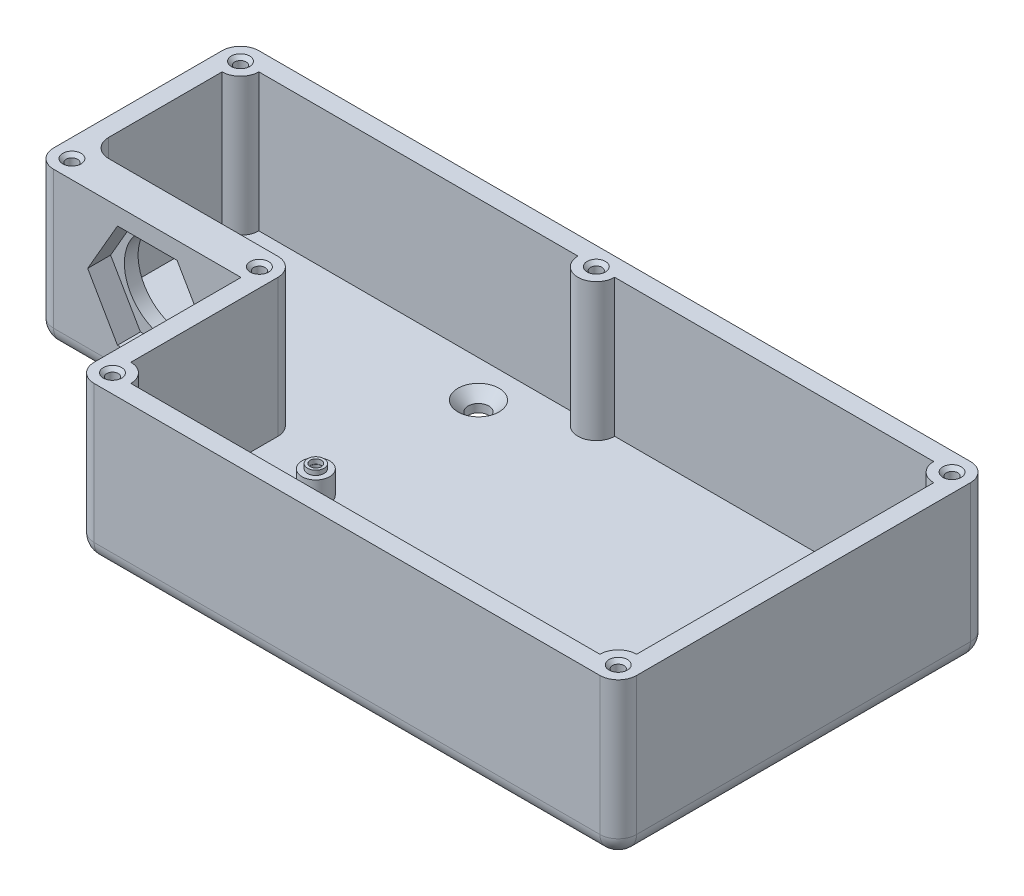
from build123d import *

# Parameters (mm, degrees)
CROQUIS3_R                                           = 3
SALIENTE_EXTRUIR1_DEPTH                              = 5
CROQUIS3_R_2                                         = 2.5
SALIENTE_EXTRUIR1_2_DEPTH                            = 5
SALIENTE_EXTRUIR1_3_DEPTH                            = 5
TALADRO_DE_MARGEN_PARA_M21_AT_2_COUNT                = 2
TALADRO_DE_MARGEN_PARA_M21_AT_2_PITCH                = 83.855175288
TALADRO_DE_MARGEN_PARA_M21_AT_3_COUNT                = 2
TALADRO_DE_MARGEN_PARA_M21_AT_3_PITCH                = 80.670217057
CROQUIS9_R                                           = 1.8
CROQUIS9_R_2                                         = 1.225
SALIENTE_EXTRUIR3_DEPTH                              = 1
SALIENTE_EXTRUIR4_DEPTH                              = 4
SALIENTE_EXTRUIR5_DEPTH                              = 30
SALIENTE_EXTRUIR5_DEPTH_BACK                         = 4
CORTAR_EXTRUIR2_DEPTH                                = 5
CROQUIS13_R                                          = 10
CORTAR_EXTRUIR3_DEPTH                                = 5
REDONDEO1_R                                          = 4
SALIENTE_EXTRUIR9_START                              = 30
CROQUIS15_R                                          = 4
SALIENTE_EXTRUIR9_DEPTH                              = 30
REFRENTADO_PARA_TORNILLO_TAP_N_CON_CABEZ_D           = 2.5
REFRENTADO_PARA_TORNILLO_TAP_N_CON_CABEZ_DEPTH       = 10
REFRENTADO_PARA_TORNILLO_TAP_N_CON_CABEZ_CSINK_D     = 4
REFRENTADO_PARA_TORNILLO_TAP_N_CON_CABEZ_CSINK_ANGLE = 90
REFRENTADO_PARA_TORNILLO_TAP_N_CON_CABEZ_TIP         = 0.751075774
REFRENTADO_PARA_TORNILLO_TAP_N_CON_C_2_D             = 4.5
REFRENTADO_PARA_TORNILLO_TAP_N_CON_C_2_DEPTH         = 10
REFRENTADO_PARA_TORNILLO_TAP_N_CON_C_2_CSINK_D       = 8.96
REFRENTADO_PARA_TORNILLO_TAP_N_CON_C_2_CSINK_ANGLE   = 90
REFRENTADO_PARA_TORNILLO_TAP_N_CON_C_2_TIP           = 1.351936393


with BuildPart() as part:
    # Croquis3 → Saliente-Extruir1 (new body)
    with BuildSketch(Plane(origin=(0, 0, 0), x_dir=(1, 0, 0), z_dir=(0, 1, 0))):
        with Locations(Location((5.2388, 19.05, 0), (0, 0, 270))):
            Circle(CROQUIS3_R)
    extrude(amount=SALIENTE_EXTRUIR1_DEPTH)

    # Croquis8 → Taladro de margen para M21 (revolve, cut)
    with BuildSketch(Plane(origin=(5.2388, 5, -19.05), x_dir=(0, 0, 1), z_dir=(1, 0, 0))):
        Polygon((0, 0), (0, 5), (1.2, 5), (1.2, 0.025), (1.225, 0), align=None)
    taladro_de_margen_para_m21 = revolve(axis=Axis((5.2388, 11.35, -19.05), (0, -1, 0)), mode=Mode.SUBTRACT)

    # Croquis9 → Saliente-Extruir3 (add)
    with BuildSketch(Plane(origin=(0, 5, 0), x_dir=(1, 0, 0), z_dir=(0, 1, 0))):
        with Locations(Location((5.2388, 19.05, 0), (0, 0, 270))):
            Circle(CROQUIS9_R)
        with Locations(Location((5.2388, 19.05, 0), (0, 0, 270))):
            Circle(CROQUIS9_R_2, mode=Mode.SUBTRACT)
    extrude(amount=SALIENTE_EXTRUIR3_DEPTH)



with BuildPart() as body_2:
    # Croquis3 → Saliente-Extruir1 2 (new body)
    with BuildSketch(Plane(origin=(0, 0, 0), x_dir=(1, 0, 0), z_dir=(0, 1, 0))):
        with Locations(Location((85.2488, 44.1516, 0), (0, 0, 270))):
            Circle(CROQUIS3_R_2)
    extrude(amount=SALIENTE_EXTRUIR1_2_DEPTH)

    # Taladro de margen para M21 at 2: Taladro de margen para M21 ×2
    with Locations(*[Vector(0.9541450450175183, 0, -0.2993446726910604) * (i * TALADRO_DE_MARGEN_PARA_M21_AT_2_PITCH) for i in range(1, TALADRO_DE_MARGEN_PARA_M21_AT_2_COUNT)]):
        add(taladro_de_margen_para_m21, mode=Mode.SUBTRACT)


with BuildPart() as body_3:
    # Croquis3 → Saliente-Extruir1 3 (new body)
    with BuildSketch(Plane(origin=(0, 0, 0), x_dir=(1, 0, 0), z_dir=(0, 1, 0))):
        with Locations(Location((85.2488, 8.7503, 0), (0, 0, 270))):
            Circle(CROQUIS3_R_2)
    extrude(amount=SALIENTE_EXTRUIR1_3_DEPTH)

    # Taladro de margen para M21 at 3: Taladro de margen para M21 ×2
    with Locations(*[Vector(0.9918158512336425, 0, 0.12767661196039432) * (i * TALADRO_DE_MARGEN_PARA_M21_AT_3_PITCH) for i in range(1, TALADRO_DE_MARGEN_PARA_M21_AT_3_COUNT)]):
        add(taladro_de_margen_para_m21, mode=Mode.SUBTRACT)


with BuildPart() as part_1:
    add(part.part)

    add(body_2.part)  # Saliente-Extruir4 merges body 2

    add(body_3.part)  # Saliente-Extruir4 merges body 3
    # Croquis10 → Saliente-Extruir4 (add)
    with BuildSketch(Plane(origin=(0, 0, 0), x_dir=(1, 0, 0), z_dir=(0, 1, 0))):
        Polygon((-10, -10), (100.17, -10), (100.17, 62.7203), (-54.8412, 62.7203), (-54.8412, 30), (-10, 30), align=None)
    extrude(amount=-SALIENTE_EXTRUIR4_DEPTH)

    # Croquis11 → Saliente-Extruir5 (add, two sides: drawn at the far end of the back side and taken through both)
    with BuildSketch(Plane(origin=(0, 0, 0), x_dir=(1, 0, 0), z_dir=(0, 1, 0)).offset(-SALIENTE_EXTRUIR5_DEPTH_BACK)):
        Polygon((104.17, -14), (104.17, 66.7203), (-58.8412, 66.7203), (-58.8412, 26), (-58.8412, 22), (-14, 22), (-14, -14), align=None)
        Polygon((100.17, -10), (100.17, 62.7203), (-54.8412, 62.7203), (-54.8412, 30), (-10, 30), (-10, -10), align=None, mode=Mode.SUBTRACT)
    extrude(amount=SALIENTE_EXTRUIR5_DEPTH + SALIENTE_EXTRUIR5_DEPTH_BACK)

    # Croquis12 → Cortar-Extruir2 (cut)
    with BuildSketch(Plane.XY.offset(-22)):
        Polygon((-21.430218943, 15), (-27.925409472, 26.25), (-40.915790528, 26.25), (-47.410981057, 15), (-40.915790528, 3.75), (-27.925409472, 3.75), align=None)
    extrude(amount=-CORTAR_EXTRUIR2_DEPTH, mode=Mode.SUBTRACT)

    # Croquis13 → Cortar-Extruir3 (cut)
    with BuildSketch(Plane.XY.offset(-27)):
        with Locations((-34.4206, 15)):
            Circle(CROQUIS13_R)
    extrude(amount=-CORTAR_EXTRUIR3_DEPTH, mode=Mode.SUBTRACT)

    # Redondeo1
    redondeo1_edges = [part_1.edges().sort_by_distance(p)[0] for p in [
        (-54.8412, 15, -62.7203),
        (-54.8412, 15, -30),
        (-10, 15, -30),
        (100.17, 15, 10),
        (-10, 15, 10),
        (100.17, 15, -62.7203),
        (104.17, 13, 14),
        (45.085, -4, 14),
        (-14, 13, 14),
        (-14, -4, -4),
        (-36.4206, -4, -22),
        (-58.8412, 13, -22),
        (-58.8412, -4, -44.36015),
        (-58.8412, 13, -66.7203),
        (22.6644, -4, -66.7203),
        (104.17, 13, -66.7203),
        (104.17, -4, -26.36015),
    ]]
    fillet(redondeo1_edges, radius=REDONDEO1_R)

    # Croquis15 → Saliente-Extruir9 (add)
    with BuildSketch(Plane(origin=(0, 0, 0), x_dir=(1, 0, 0), z_dir=(0, 1, 0)).offset(SALIENTE_EXTRUIR9_START)):
        with Locations((-54.8412, 62.7203)):
            Circle(CROQUIS15_R)
        with Locations((100.17, 62.7203)):
            Circle(CROQUIS15_R)
        with Locations((100.17, -10)):
            Circle(CROQUIS15_R)
        with Locations((-10, -10)):
            Circle(CROQUIS15_R)
        with Locations((-14, 26)):
            Circle(CROQUIS15_R)
        with Locations((-54.8412, 26)):
            Circle(CROQUIS15_R)
        with Locations((22.6644, 62.7203)):
            Circle(CROQUIS15_R)
    extrude(amount=-SALIENTE_EXTRUIR9_DEPTH)

    # Refrentado para tornillo tap_n con cabez
    with Locations(Plane(origin=(0, 30, 0), x_dir=(1, 0, 0), z_dir=(0, 1, 0))):
        with Locations((-54.8412, 62.7203), (-54.8412, 26), (-14, 26), (-10, -10), (100.17, -10), (100.17, 62.7203), (22.6644, 62.7203)):
            CounterSinkHole(REFRENTADO_PARA_TORNILLO_TAP_N_CON_CABEZ_D / 2, REFRENTADO_PARA_TORNILLO_TAP_N_CON_CABEZ_CSINK_D / 2, depth=REFRENTADO_PARA_TORNILLO_TAP_N_CON_CABEZ_DEPTH, counter_sink_angle=REFRENTADO_PARA_TORNILLO_TAP_N_CON_CABEZ_CSINK_ANGLE)
            with Locations((0, 0, -(REFRENTADO_PARA_TORNILLO_TAP_N_CON_CABEZ_DEPTH + REFRENTADO_PARA_TORNILLO_TAP_N_CON_CABEZ_TIP / 2))):  # 118° drill point
                Cone(0, REFRENTADO_PARA_TORNILLO_TAP_N_CON_CABEZ_D / 2, REFRENTADO_PARA_TORNILLO_TAP_N_CON_CABEZ_TIP, mode=Mode.SUBTRACT)

    # Refrentado para tornillo tap_n con c 2
    with Locations(Plane(origin=(0, 0, 0), x_dir=(1, 0, 0), z_dir=(0, 1, 0))):
        with Locations((5, 54.7203), (85.17, 54.7203), (85.17, -2), (5, -2)):
            CounterSinkHole(REFRENTADO_PARA_TORNILLO_TAP_N_CON_C_2_D / 2, REFRENTADO_PARA_TORNILLO_TAP_N_CON_C_2_CSINK_D / 2, depth=REFRENTADO_PARA_TORNILLO_TAP_N_CON_C_2_DEPTH, counter_sink_angle=REFRENTADO_PARA_TORNILLO_TAP_N_CON_C_2_CSINK_ANGLE)
            with Locations((0, 0, -(REFRENTADO_PARA_TORNILLO_TAP_N_CON_C_2_DEPTH + REFRENTADO_PARA_TORNILLO_TAP_N_CON_C_2_TIP / 2))):  # 118° drill point
                Cone(0, REFRENTADO_PARA_TORNILLO_TAP_N_CON_C_2_D / 2, REFRENTADO_PARA_TORNILLO_TAP_N_CON_C_2_TIP, mode=Mode.SUBTRACT)


solid = part_1.part
